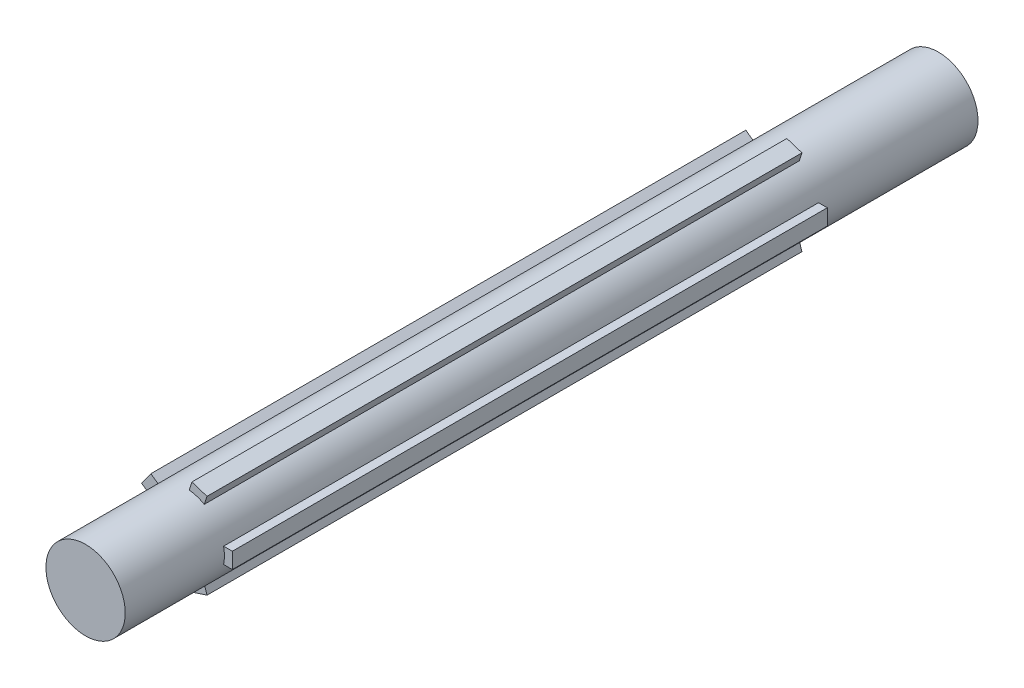
from build123d import *
from build123d.topology import SkipClean

# Parameters (mm, degrees)
BOSS_EXTRUDE1_DEPTH = 150
BOSS_EXTRUDE2_START = 25
SKETCH2_R           = 10
BOSS_EXTRUDE2_DEPTH = 25
SKETCH3_R           = 10
BOSS_EXTRUDE3_DEPTH = 40


with BuildPart() as part:
    # Sketch1 → Boss-Extrude1 (new body)
    with BuildSketch(Plane.XY):
        with BuildLine():
            Line((9.797958971, 2), (12, 2))
            Line((12, 2), (12, -2))
            Line((12, -2), (9.797958971, -2))
            ThreePointArc((9.797958971, -2), (8.090169944, -5.877852523), (4.929848865, -8.700378737))
            Line((4.929848865, -8.700378737), (5.610316965, -10.794644207))
            Line((5.610316965, -10.794644207), (1.8060909, -12.030712184))
            Line((1.8060909, -12.030712184), (1.1256228, -9.936446715))
            ThreePointArc((1.1256228, -9.936446715), (-3.090169944, -9.510565163), (-6.751144813, -7.377129775))
            Line((-6.751144813, -7.377129775), (-8.532633428, -8.671457016))
            Line((-8.532633428, -8.671457016), (-10.883774437, -5.435389039))
            Line((-10.883774437, -5.435389039), (-9.102285822, -4.141061797))
            ThreePointArc((-9.102285822, -4.141061797), (-10, 0), (-9.102285822, 4.141061797))
            Line((-9.102285822, 4.141061797), (-10.883774437, 5.435389039))
            Line((-10.883774437, 5.435389039), (-8.532633428, 8.671457016))
            Line((-8.532633428, 8.671457016), (-6.751144813, 7.377129775))
            ThreePointArc((-6.751144813, 7.377129775), (-3.090169944, 9.510565163), (1.1256228, 9.936446715))
            Line((1.1256228, 9.936446715), (1.8060909, 12.030712184))
            Line((1.8060909, 12.030712184), (5.610316965, 10.794644207))
            Line((5.610316965, 10.794644207), (4.929848865, 8.700378737))
            ThreePointArc((4.929848865, 8.700378737), (8.090169944, 5.877852523), (9.797958971, 2))
        make_face()
    extrude(amount=-BOSS_EXTRUDE1_DEPTH)

    # Sketch2 → Boss-Extrude2 (add)
    with SkipClean():  # the faces are left unmerged after this step: merging them gives an invalid solid
        with BuildSketch(Plane.XY.offset(BOSS_EXTRUDE2_START)):
            Circle(SKETCH2_R)
        extrude(amount=-BOSS_EXTRUDE2_DEPTH)

    # Sketch3 → Boss-Extrude3 (add)
    with SkipClean():  # the faces are left unmerged after this step: merging them gives an invalid solid
        with BuildSketch(Plane(origin=(0, 0, -150), x_dir=(-1, 0, 0), z_dir=(0, 0, -1))):
            with Locations(Location((0, 0, 0), (0, 0, 180))):
                Circle(SKETCH3_R)
        extrude(amount=BOSS_EXTRUDE3_DEPTH)


solid = part.part
